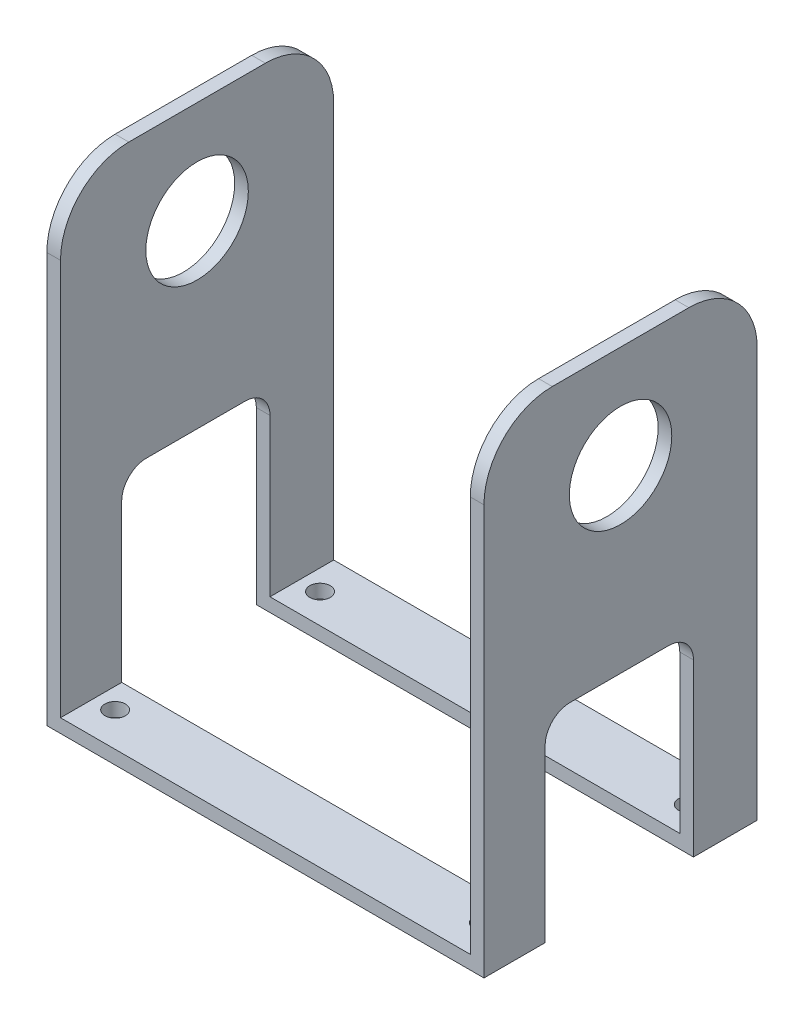
from build123d import *

# Parameters (mm, degrees)
EXTRUDE_THIN1_DEPTH = 40
CUT_EXTRUDE2_DEPTH  = 60
FILLET1_R           = 10
SKETCH3_R           = 1.5
CUT_EXTRUDE4_DEPTH  = 20


with BuildPart() as part:
    # Sketch1 → Extrude-Thin1 (new body)
    with BuildSketch(Plane.XY):
        Polygon((-32, 0), (0, 0), (0, 70), (-2, 70), (-2, 2), (-32, 2), align=None)
    extrude(amount=EXTRUDE_THIN1_DEPTH)

    # Sketch2 → Cut-Extrude2 (cut)
    with BuildSketch(Plane(origin=(0, 0, 0), x_dir=(0, 0, -1), z_dir=(1, 0, 0))):
        with BuildLine():
            ThreePointArc((-20, 62.5), (-27.5, 55), (-20, 47.5))
            Line((-20, 47.5), (-20, 62.5))
        make_face()
        with BuildLine():
            Line((-20, 62.5), (-20, 47.5))
            ThreePointArc((-20, 47.5), (-14.696699141, 49.696699141), (-12.5, 55))
            ThreePointArc((-12.5, 55), (-14.696699141, 60.303300859), (-20, 62.5))
        make_face()
        with BuildLine():
            Line((-9.327670915, 25), (-9.327670915, 0))
            Line((-9.327670915, 0), (-31.039452712, 0))
            Line((-31.039452712, 0), (-31.039452712, 25))
            ThreePointArc((-31.039452712, 25), (-29.976608153, 27.56593375), (-27.410674402, 28.62877831))
            Line((-27.410674402, 28.62877831), (-12.956449225, 28.62877831))
            ThreePointArc((-12.956449225, 28.62877831), (-10.390515474, 27.56593375), (-9.327670915, 25))
        make_face()
    extrude(amount=-CUT_EXTRUDE2_DEPTH, mode=Mode.SUBTRACT)

    # Fillet1
    fillet1_edges = [part.edges().sort_by_distance(p)[0] for p in [
        (-1, 70, 0),
        (-1, 70, 40),
    ]]
    fillet(fillet1_edges, radius=FILLET1_R)

    # Mirror1: part across plane


with BuildPart() as part_1:
    add(part.part)
    add(part.part.mirror(Plane(origin=(-32, 0, 40), x_dir=(0, 0, 1), z_dir=(-1, 0, 0))))

    # Sketch3 → Cut-Extrude4 (cut)
    with BuildSketch(Plane.XZ):
        with Locations(Location((-59, 35, 0), (0, 0, 270))):
            Circle(SKETCH3_R)
        with Locations(Location((-5, 35, 0), (0, 0, 270))):
            Circle(SKETCH3_R)
        with Locations(Location((-5, 5, 0), (0, 0, 270))):
            Circle(SKETCH3_R)
        with Locations(Location((-59, 5, 0), (0, 0, 270))):
            Circle(SKETCH3_R)
    extrude(amount=-CUT_EXTRUDE4_DEPTH, mode=Mode.SUBTRACT)


solid = part_1.part
